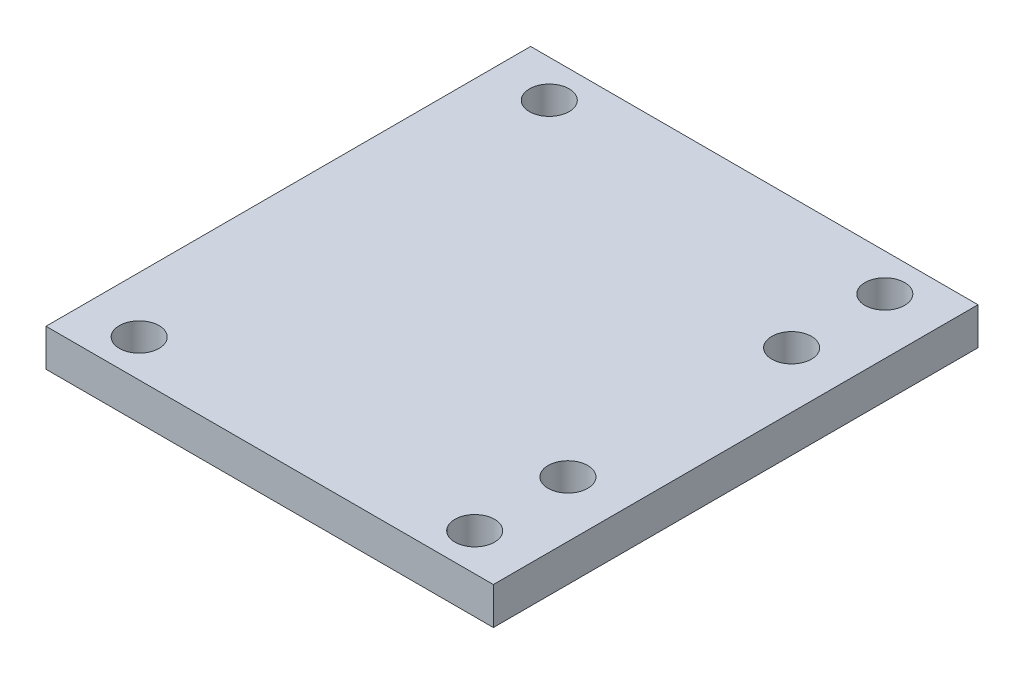
from build123d import *

# Parameters (mm, degrees)
SKETCH1_W               = 76.2
SKETCH1_H               = 82.55
BOSS_EXTRUDE1_DEPTH     = 6.35
F_1_4_CLEARANCE_HOLE1_D = 6.7564


with BuildPart() as part:
    # Sketch1 → Boss-Extrude1 (new body)
    with BuildSketch(Plane(origin=(0, 0, 0), x_dir=(1, 0, 0), z_dir=(0, 1, 0))):
        Rectangle(SKETCH1_W, SKETCH1_H)
    extrude(amount=BOSS_EXTRUDE1_DEPTH)

    # 1/4 Clearance Hole1 (through all)
    with Locations(Plane(origin=(0, 6.35, 0), x_dir=(-1, 0, 0), z_dir=(0, 1, 0))):
        with Locations((28.575, -34.925), (-28.575, -34.925), (-28.575, -19.05), (-28.575, 19.05), (28.575, 34.925), (-28.575, 34.925)):
            Hole(F_1_4_CLEARANCE_HOLE1_D / 2)


solid = part.part
